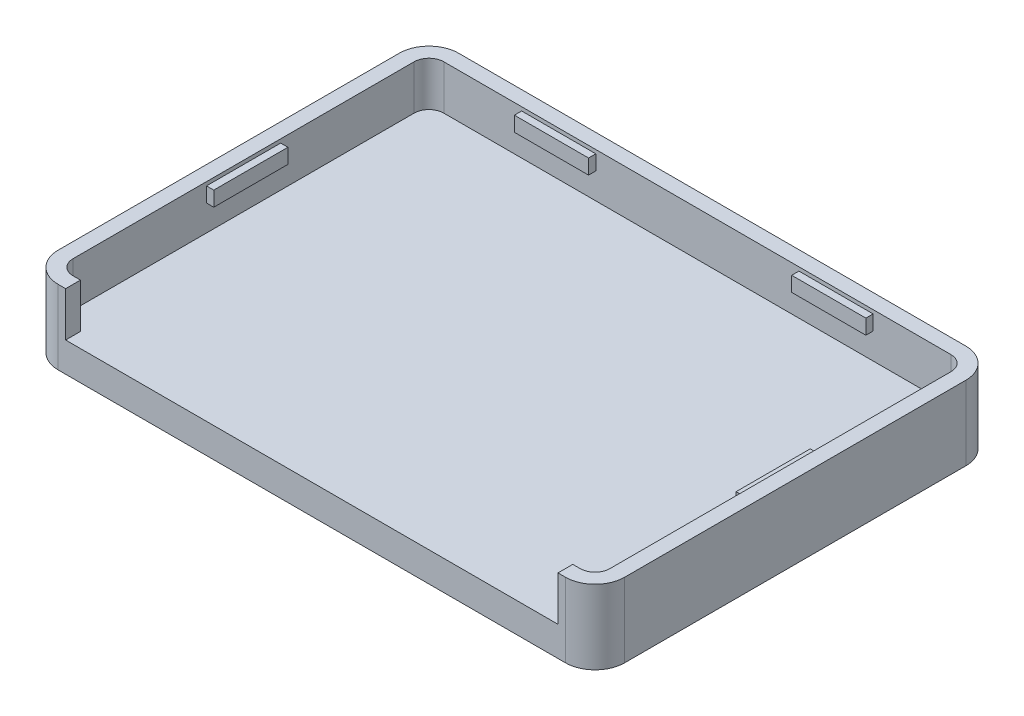
from build123d import *

# Parameters (mm, degrees)
BOSS_EXTRU_1_DEPTH      = 5
ENL_V_MAT_EXTRU_1_DEPTH = 3
ESQUISSE3_W             = 33.2
ESQUISSE3_H             = 3
ENL_V_MAT_EXTRU_2_DEPTH = 3
ESQUISSE4_W             = 5
ESQUISSE4_H             = 1
BOSS_EXTRU_2_DEPTH      = 0.48904
ESQUISSE5_W             = 5
ESQUISSE5_H             = 1
BOSS_EXTRU_3_DEPTH      = 0.48904
ESQUISSE6_W             = 5
ESQUISSE6_H             = 1
BOSS_EXTRU_4_DEPTH      = 0.48904


with BuildPart() as part:
    # Esquisse1 → Boss.-Extru.1 (new body)
    with BuildSketch(Plane(origin=(0, 0, 0), x_dir=(1, 0, 0), z_dir=(0, 1, 0))):
        with BuildLine():
            Line((2, 0), (36.2, 0))
            ThreePointArc((36.2, 0), (37.614213562, 0.585786438), (38.2, 2))
            Line((38.2, 2), (38.2, 25))
            ThreePointArc((38.2, 25), (37.614213562, 26.414213562), (36.2, 27))
            Line((36.2, 27), (2, 27))
            ThreePointArc((2, 27), (0.585786438, 26.414213562), (0, 25))
            Line((0, 25), (0, 2))
            ThreePointArc((0, 2), (0.585786438, 0.585786438), (2, 0))
        make_face()
    extrude(amount=BOSS_EXTRU_1_DEPTH)

    # Esquisse2 → Enlèv. mat.-Extru.1 (cut)
    with BuildSketch(Plane(origin=(0, 5, 0), x_dir=(1, 0, 0), z_dir=(0, 1, 0))):
        with BuildLine():
            Line((37.2, 2), (37.2, 25))
            ThreePointArc((37.2, 25), (36.907106781, 25.707106781), (36.2, 26))
            Line((36.2, 26), (2, 26))
            ThreePointArc((2, 26), (1.292893219, 25.707106781), (1, 25))
            Line((1, 25), (1, 2))
            ThreePointArc((1, 2), (1.292893219, 1.292893219), (2, 1))
            Line((2, 1), (36.2, 1))
            ThreePointArc((36.2, 1), (36.907106781, 1.292893219), (37.2, 2))
        make_face()
    extrude(amount=-ENL_V_MAT_EXTRU_1_DEPTH, mode=Mode.SUBTRACT)

    # Esquisse3 → Enlèv. mat.-Extru.2 (cut)
    with BuildSketch(Plane.XY):
        with Locations((19.1, 3.5)):
            Rectangle(ESQUISSE3_W, ESQUISSE3_H)
    extrude(amount=-ENL_V_MAT_EXTRU_2_DEPTH, mode=Mode.SUBTRACT)

    # Esquisse4 → Boss.-Extru.2 (add)
    with BuildSketch(Plane(origin=(1, 0, 0), x_dir=(0, 0, -1), z_dir=(1, 0, 0))):
        with Locations((13.5, 4.25)):
            Rectangle(ESQUISSE4_W, ESQUISSE4_H)
    extrude(amount=BOSS_EXTRU_2_DEPTH)

    # Esquisse5 → Boss.-Extru.3 (add)
    with BuildSketch(Plane.ZY.offset(-37.2)):
        with Locations((-13.5, 4.25)):
            Rectangle(ESQUISSE5_W, ESQUISSE5_H)
    extrude(amount=BOSS_EXTRU_3_DEPTH)

    # Esquisse6 → Boss.-Extru.4 (add)
    with BuildSketch(Plane.XY.offset(-26)):
        with Locations((9.75, 4.25)):
            Rectangle(ESQUISSE6_W, ESQUISSE6_H)
        with Locations((28.45, 4.25)):
            Rectangle(ESQUISSE6_W, ESQUISSE6_H)
    extrude(amount=BOSS_EXTRU_4_DEPTH)


solid = part.part
